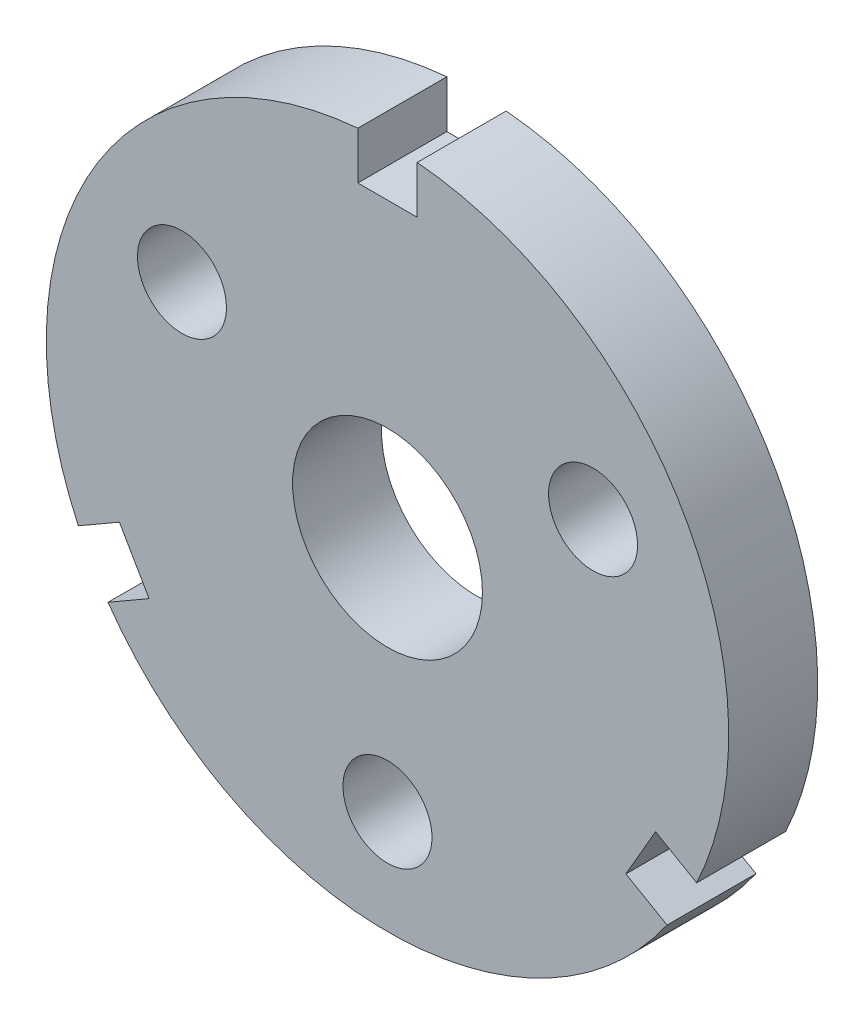
from build123d import *

# Parameters (mm, degrees)
SKETCH1_R           = 16
SKETCH1_R_2         = 7.5
BOSS_EXTRUDE1_DEPTH = 15


with BuildPart() as part:
    # Sketch1 → Boss-Extrude1 (new body)
    with BuildSketch(Plane.XY):
        with BuildLine():
            Line((5, 57.282196187), (5, 49.282196187))
            Line((5, 49.282196187), (-5, 49.282196187))
            Line((-5, 49.282196187), (-5, 57.282196187))
            ThreePointArc((-5, 57.282196187), (-49.796460718, 28.75), (-52.107837082, -24.310971075))
            Line((-52.107837082, -24.310971075), (-45.179633852, -20.310971075))
            Line((-45.179633852, -20.310971075), (-40.179633852, -28.971225112))
            Line((-40.179633852, -28.971225112), (-47.107837082, -32.971225112))
            ThreePointArc((-47.107837082, -32.971225112), (0, -57.5), (47.107837082, -32.971225112))
            Line((47.107837082, -32.971225112), (40.179633852, -28.971225112))
            Line((40.179633852, -28.971225112), (45.179633852, -20.310971075))
            Line((45.179633852, -20.310971075), (52.107837082, -24.310971075))
            ThreePointArc((52.107837082, -24.310971075), (49.796460718, 28.75), (5, 57.282196187))
        make_face()
        Circle(SKETCH1_R, mode=Mode.SUBTRACT)
        with Locations((0, -40)):
            Circle(SKETCH1_R_2, mode=Mode.SUBTRACT)
        with Locations((-34.641016151, 20)):
            Circle(SKETCH1_R_2, mode=Mode.SUBTRACT)
        with Locations((34.641016151, 20)):
            Circle(SKETCH1_R_2, mode=Mode.SUBTRACT)
    extrude(amount=BOSS_EXTRUDE1_DEPTH)


solid = part.part
